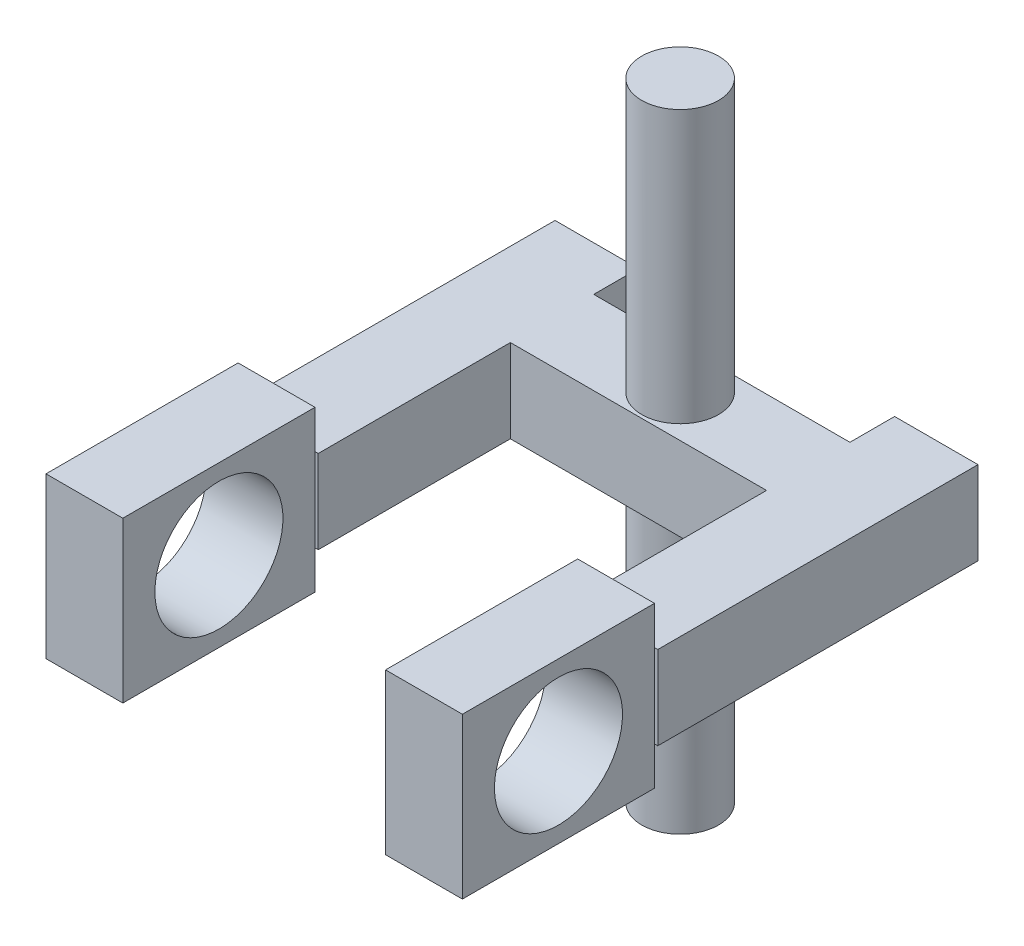
from build123d import *

# Parameters (mm, degrees)
SKETCH1_R                = 6
BOSS_EXTRUDE1_DEPTH      = 98
BOSS_EXTRUDE2_START      = -42.489
SKETCH2_W                = 40
SKETCH2_H                = 13.022
BOSS_EXTRUDE2_DEPTH      = 13.022
BOSS_EXTRUDE3_DEPTH      = 30
BOSS_EXTRUDE3_DEPTH_BACK = 20
SKETCH4_W                = 13.022
SKETCH4_H                = 13.022
SKETCH6_W                = 10.902
SKETCH6_H                = 10.902
CUT_EXTRUDE1_DEPTH       = 60
BOSS_EXTRUDE4_START      = 10
SKETCH7_W                = 10.902
SKETCH7_H                = 10.902
BOSS_EXTRUDE4_DEPTH      = 20
SKETCH8_W                = 12
SKETCH8_H                = 25
BOSS_EXTRUDE5_DEPTH      = 30
SKETCH9_R                = 10
CUT_EXTRUDE2_DEPTH       = 100


with BuildPart() as part:
    # Sketch1 → Boss-Extrude1 (new body)
    with BuildSketch(Plane(origin=(0, 0, 0), x_dir=(1, 0, 0), z_dir=(0, 1, 0))):
        with Locations(Location((0, 0, 0), (0, 0, 270))):
            Circle(SKETCH1_R)
    extrude(amount=BOSS_EXTRUDE1_DEPTH)

    # Sketch2 → Boss-Extrude2 (add)
    with BuildSketch(Plane(origin=(0, 98, 0), x_dir=(1, 0, 0), z_dir=(0, 1, 0)).offset(BOSS_EXTRUDE2_START)):
        Rectangle(SKETCH2_W, SKETCH2_H)
    extrude(amount=-BOSS_EXTRUDE2_DEPTH)

    # Sketch4 → Boss-Extrude3 (add, two sides: drawn at the far end of the back side and taken through both)
    with BuildSketch(Plane.XY.offset(6.511).offset(-BOSS_EXTRUDE3_DEPTH_BACK)):
        with Locations((-26.511, 49)):
            Rectangle(SKETCH4_W, SKETCH4_H)
        with Locations((26.511, 49)):
            Rectangle(SKETCH4_W, SKETCH4_H)
    extrude(amount=BOSS_EXTRUDE3_DEPTH + BOSS_EXTRUDE3_DEPTH_BACK)

    # Sketch6 → Cut-Extrude1 (cut)
    with BuildSketch(Plane.XY.offset(36.511)):
        with Locations((-26.511, 49)):
            Rectangle(SKETCH6_W, SKETCH6_H)
        with Locations((26.511, 49)):
            Rectangle(SKETCH6_W, SKETCH6_H)
    extrude(amount=-CUT_EXTRUDE1_DEPTH, mode=Mode.SUBTRACT)

    # Sketch7 → Boss-Extrude4 (add)
    with BuildSketch(Plane.XY.offset(6.511).offset(BOSS_EXTRUDE4_START)):
        with Locations((-26.511, 49)):
            Rectangle(SKETCH7_W, SKETCH7_H)
        with Locations((26.511, 49)):
            Rectangle(SKETCH7_W, SKETCH7_H)
    extrude(amount=BOSS_EXTRUDE4_DEPTH)

    # Sketch8 → Boss-Extrude5 (add)
    with BuildSketch(Plane.XY.offset(36.511)):
        with Locations((-26.511, 49)):
            Rectangle(SKETCH8_W, SKETCH8_H)
        with Locations((26.511, 49)):
            Rectangle(SKETCH8_W, SKETCH8_H)
    extrude(amount=BOSS_EXTRUDE5_DEPTH)

    # Sketch9 → Cut-Extrude2 (cut)
    with BuildSketch(Plane.ZY.offset(32.511)):
        with Locations((51.511, 49)):
            Circle(SKETCH9_R)
    extrude(amount=-CUT_EXTRUDE2_DEPTH, mode=Mode.SUBTRACT)


solid = part.part
